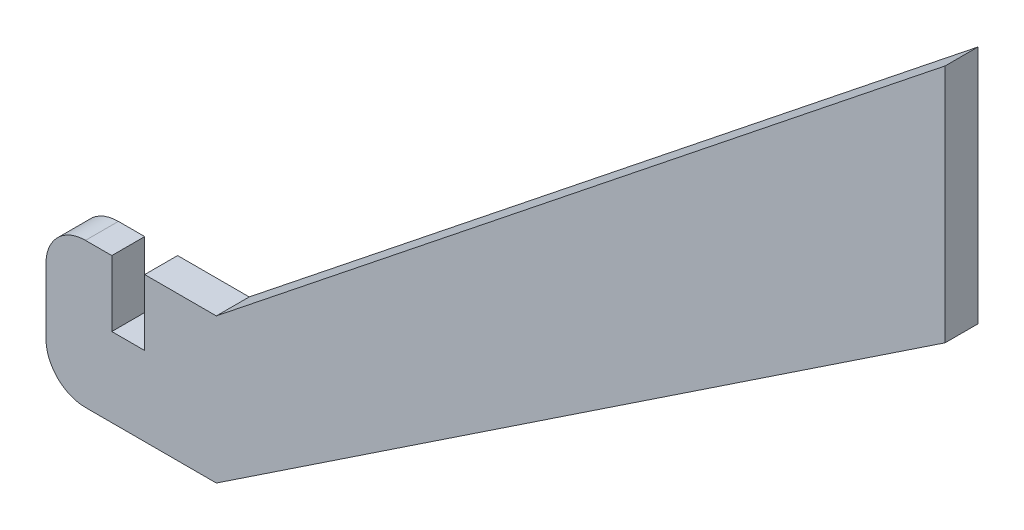
from build123d import *

# Parameters (mm, degrees)
BOSS_EXTRUDE1_DEPTH = 0.125
FILLET1_R           = 0.3


with BuildPart() as part:
    # frame_outline → Boss-Extrude1 (new, symmetric)
    with BuildSketch(Plane.XY):
        Polygon((0, 0), (0, 1.1), (0.5, 1.1), (0.5, 0.6), (0.75, 0.6), (0.75, 1.1), (1.294312935, 1.1), (6.832215904, 5.513992793), (6.832215904, 3.691761529), (1.294312935, 0), align=None)
    extrude(amount=BOSS_EXTRUDE1_DEPTH, both=True)

    # Fillet1
    fillet1_edges = [part.edges().sort_by_distance(p)[0] for p in [
        (0, 0, 0),
        (0, 1.1, 0),
    ]]
    fillet(fillet1_edges, radius=FILLET1_R)


solid = part.part
